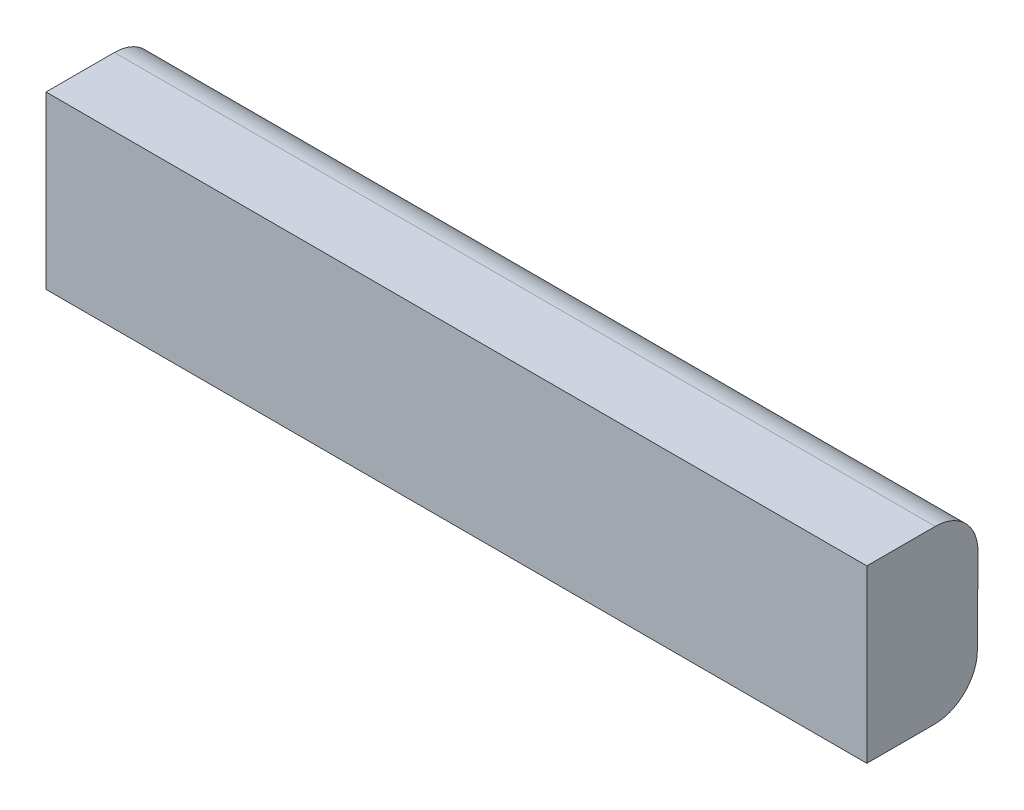
from build123d import *

# Parameters (mm, degrees)
BOSS_EXTRUDE1_DEPTH = 609.6


with BuildPart() as part:
    # Sketch1 → Boss-Extrude1 (new body)
    with BuildSketch(Plane(origin=(0, 0, 0), x_dir=(0, 0, -1), z_dir=(1, 0, 0))):
        with BuildLine():
            Line((-17.142297556, 84.179561101), (-67.942297556, 84.179561101))
            Line((-67.942297556, 84.179561101), (-67.942297556, -42.820438899))
            Line((-67.942297556, -42.820438899), (-17.619147927, -42.820438899))
            ThreePointArc((-17.619147927, -42.820438899), (4.831492375, -33.521079202), (14.130852073, -11.070438899))
            Line((14.130852073, -11.070438899), (14.607702444, 52.429561101))
            ThreePointArc((14.607702444, 52.429561101), (5.308342747, 74.880201403), (-17.142297556, 84.179561101))
        make_face()
    extrude(amount=BOSS_EXTRUDE1_DEPTH)


solid = part.part
